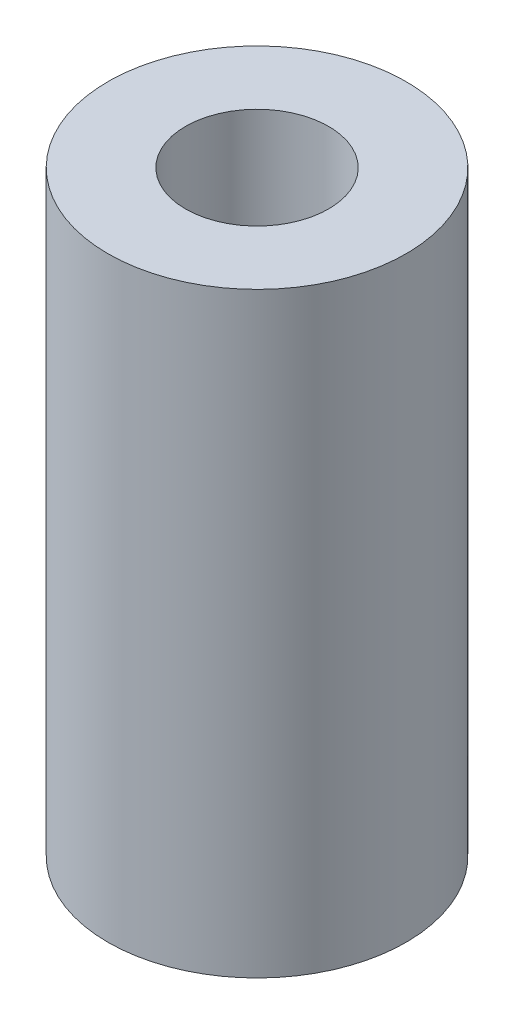
from build123d import *

# Parameters (mm, degrees)
SKIZZE1_R                       = 2.5
AUFSATZ_LINEAR_AUSTRAGEN1_DEPTH = 10
SKIZZE2_R                       = 1.2
SCHNITT_LINEAR_AUSTRAGEN1_DEPTH = 3
SCHNITT_LINEAR_START            = -3
SKIZZE3_R                       = 1.2
SCHNITT_LINEAR_AUSTRAGEN2_DEPTH = 3


with BuildPart() as part:
    # Skizze1 → Aufsatz-Linear austragen1 (new body)
    with BuildSketch(Plane(origin=(0, 0, 0), x_dir=(1, 0, 0), z_dir=(0, 1, 0))):
        with Locations(Location((0, 0, 0), (0, 0, 270))):
            Circle(SKIZZE1_R)
    extrude(amount=AUFSATZ_LINEAR_AUSTRAGEN1_DEPTH)

    # Skizze2 → Schnitt-Linear austragen1 (cut)
    with BuildSketch(Plane(origin=(0, 10, 0), x_dir=(1, 0, 0), z_dir=(0, 1, 0))):
        with Locations(Location((0, 0, 0), (0, 0, 270))):
            Circle(SKIZZE2_R)
    extrude(amount=-SCHNITT_LINEAR_AUSTRAGEN1_DEPTH, mode=Mode.SUBTRACT)

    # Skizze3 → Schnitt-Linear austragen2 (cut)
    with BuildSketch(Plane.XZ.offset(SCHNITT_LINEAR_START)):
        with Locations(Location((0, 0, 0), (0, 0, 90))):
            Circle(SKIZZE3_R)
    extrude(amount=SCHNITT_LINEAR_AUSTRAGEN2_DEPTH, mode=Mode.SUBTRACT)


solid = part.part
